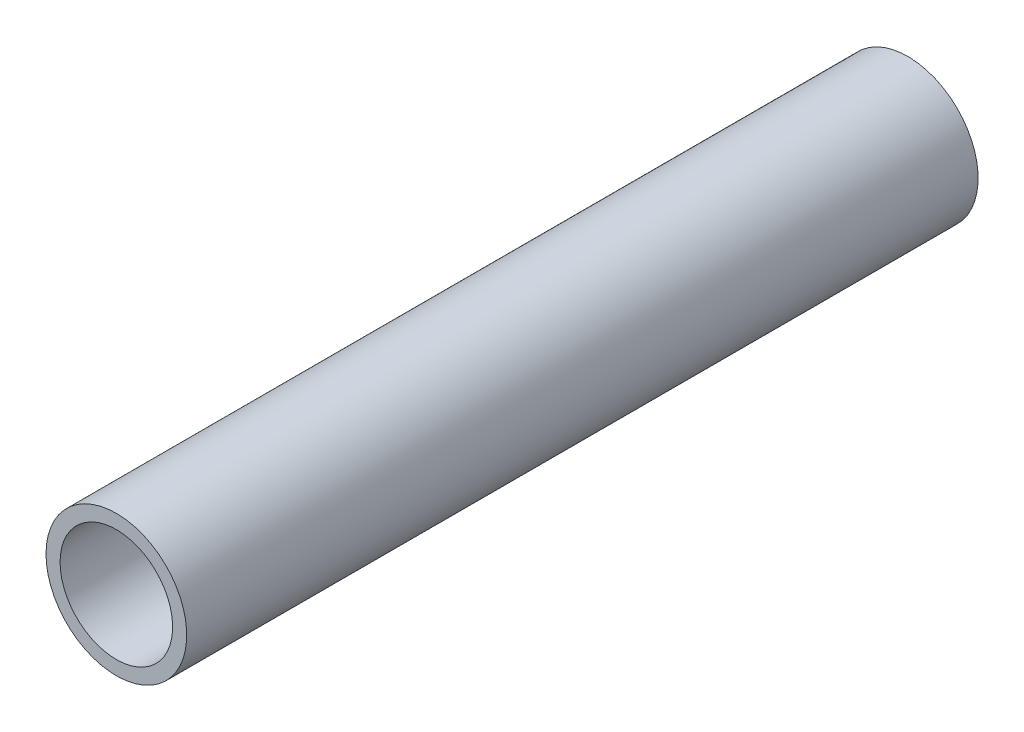
from build123d import *

# Parameters (mm, degrees)
SKETCH_1_R      = 2
SKETCH_1_R_2    = 1.6
EXTRUDE_1_DEPTH = 22.5


with BuildPart() as part:
    # 草图1 → 凸台-拉伸1 (new body)
    with BuildSketch(Plane.XY):
        with Locations(Location((0, 0, 0), (0, 0, 180))):
            Circle(SKETCH_1_R)
        with Locations(Location((0, 0, 0), (0, 0, 180))):
            Circle(SKETCH_1_R_2, mode=Mode.SUBTRACT)
    extrude(amount=EXTRUDE_1_DEPTH)


solid = part.part
